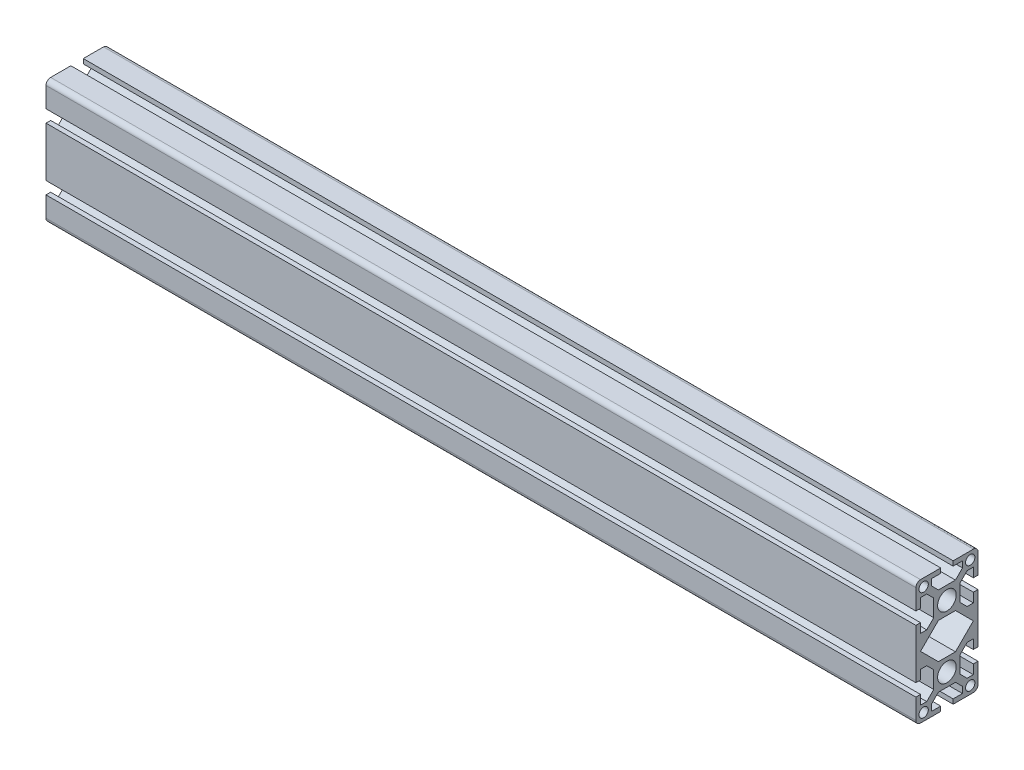
from build123d import *

# Parameters (mm, degrees)
SKETCH1_R           = 6
SKETCH1_R_2         = 3
BOSS_EXTRUDE1_DEPTH = 560


with BuildPart() as part:
    # Sketch1 → Boss-Extrude1 (new body)
    with BuildSketch(Plane(origin=(0, 0, 0), x_dir=(0, 0, -1), z_dir=(1, 0, 0))):
        with BuildLine():
            Line((-20, -4), (-17, -4))
            Line((-17, -4), (-17, -10))
            Line((-17, -10), (-13, -10))
            Line((-13, -10), (-8.5, -5.5))
            Line((-8.5, -5.5), (-8.5, 5.5))
            Line((-8.5, 5.5), (-13, 10))
            Line((-13, 10), (-17, 10))
            Line((-17, 10), (-17, 4))
            Line((-17, 4), (-20, 4))
            Line((-20, 4), (-20, 36))
            Line((-20, 36), (-17, 36))
            Line((-17, 36), (-17, 30))
            Line((-17, 30), (-13, 30))
            Line((-13, 30), (-8.5, 34.5))
            Line((-8.5, 34.5), (-8.5, 45.5))
            Line((-8.5, 45.5), (-13, 50))
            Line((-13, 50), (-17, 50))
            Line((-17, 50), (-17, 44))
            Line((-17, 44), (-20, 44))
            Line((-20, 44), (-20, 57))
            ThreePointArc((-20, 57), (-19.121320344, 59.121320344), (-17, 60))
            Line((-17, 60), (-4, 60))
            Line((-4, 60), (-4, 57))
            Line((-4, 57), (-10, 57))
            Line((-10, 57), (-10, 53))
            Line((-10, 53), (-5.5, 48.5))
            Line((-5.5, 48.5), (5.5, 48.5))
            Line((5.5, 48.5), (10, 53))
            Line((10, 53), (10, 57))
            Line((10, 57), (4, 57))
            Line((4, 57), (4, 60))
            Line((4, 60), (17, 60))
            ThreePointArc((17, 60), (19.121320344, 59.121320344), (20, 57))
            Line((20, 57), (20, 44))
            Line((20, 44), (17, 44))
            Line((17, 44), (17, 50))
            Line((17, 50), (13, 50))
            Line((13, 50), (8.5, 45.5))
            Line((8.5, 45.5), (8.5, 34.5))
            Line((8.5, 34.5), (13, 30))
            Line((13, 30), (17, 30))
            Line((17, 30), (17, 36))
            Line((17, 36), (20, 36))
            Line((20, 36), (20, 20))
            Line((20, 20), (20, 4))
            Line((20, 4), (17, 4))
            Line((17, 4), (17, 10))
            Line((17, 10), (13, 10))
            Line((13, 10), (8.5, 5.5))
            Line((8.5, 5.5), (8.5, -5.5))
            Line((8.5, -5.5), (13, -10))
            Line((13, -10), (17, -10))
            Line((17, -10), (17, -4))
            Line((17, -4), (20, -4))
            Line((20, -4), (20, -17))
            ThreePointArc((20, -17), (19.121320344, -19.121320344), (17, -20))
            Line((17, -20), (4, -20))
            Line((4, -20), (4, -17))
            Line((4, -17), (10, -17))
            Line((10, -17), (10, -13))
            Line((10, -13), (5.5, -8.5))
            Line((5.5, -8.5), (-5.5, -8.5))
            Line((-5.5, -8.5), (-10, -13))
            Line((-10, -13), (-10, -17))
            Line((-10, -17), (-4, -17))
            Line((-4, -17), (-4, -20))
            Line((-4, -20), (-17, -20))
            ThreePointArc((-17, -20), (-19.121320344, -19.121320344), (-20, -17))
            Line((-20, -17), (-20, -4))
        make_face()
        Circle(SKETCH1_R, mode=Mode.SUBTRACT)
        with Locations((-15, -15)):
            Circle(SKETCH1_R_2, mode=Mode.SUBTRACT)
        with Locations((15, 55)):
            Circle(SKETCH1_R_2, mode=Mode.SUBTRACT)
        with Locations((-15, 55)):
            Circle(SKETCH1_R_2, mode=Mode.SUBTRACT)
        with Locations((15, -15)):
            Circle(SKETCH1_R_2, mode=Mode.SUBTRACT)
        with Locations((0, 40)):
            Circle(SKETCH1_R, mode=Mode.SUBTRACT)
        Polygon((-5.5, 8.5), (-17, 20), (-5.5, 31.5), (5.5, 31.5), (17, 20), (5.5, 8.5), align=None, mode=Mode.SUBTRACT)
    extrude(amount=BOSS_EXTRUDE1_DEPTH)


solid = part.part
